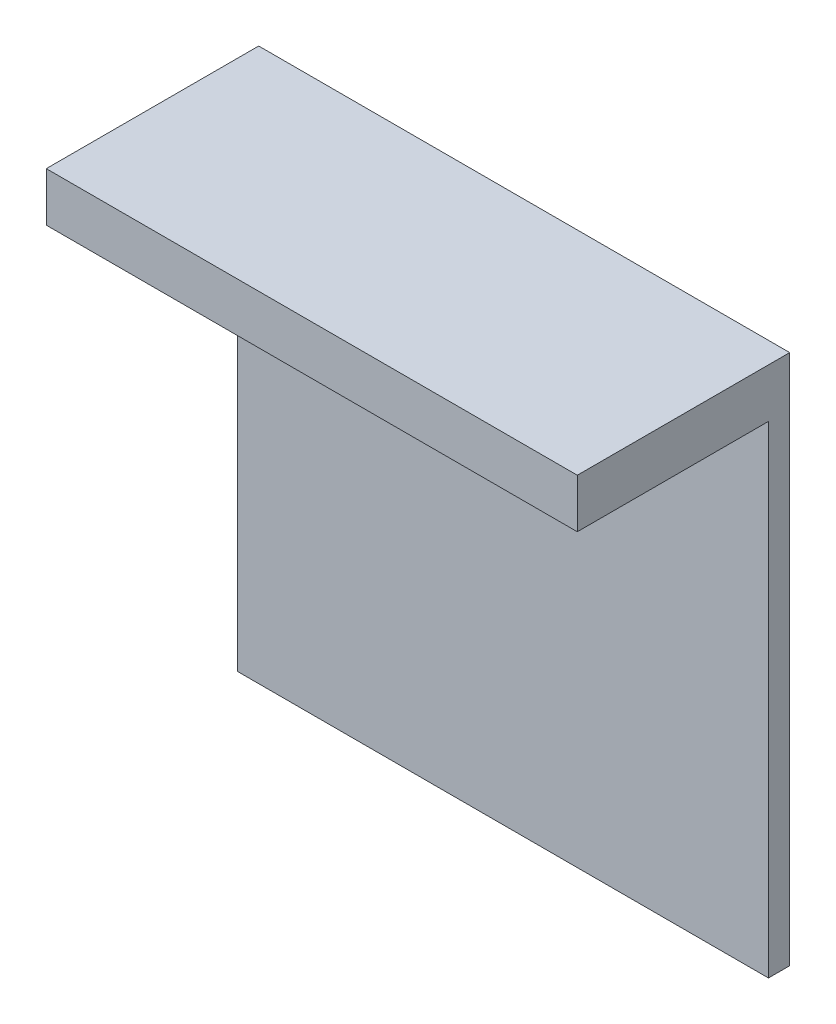
from build123d import *

# Parameters (mm, degrees)
SKETCH1_W           = 500
SKETCH1_H           = 200
BOSS_EXTRUDE1_DEPTH = 500
SKETCH2_W           = 500
SKETCH2_H           = 453.889764575
CUT_EXTRUDE1_DEPTH  = 180


with BuildPart() as part:
    # Sketch1 → Boss-Extrude1 (new body)
    with BuildSketch(Plane(origin=(0, 0, 0), x_dir=(1, 0, 0), z_dir=(0, 1, 0))):
        Rectangle(SKETCH1_W, SKETCH1_H)
    extrude(amount=-BOSS_EXTRUDE1_DEPTH)

    # Sketch2 → Cut-Extrude1 (cut)
    with BuildSketch(Plane.XY.offset(100)):
        with Locations((0, -273.055117713)):
            Rectangle(SKETCH2_W, SKETCH2_H)
    extrude(amount=-CUT_EXTRUDE1_DEPTH, mode=Mode.SUBTRACT)


solid = part.part
